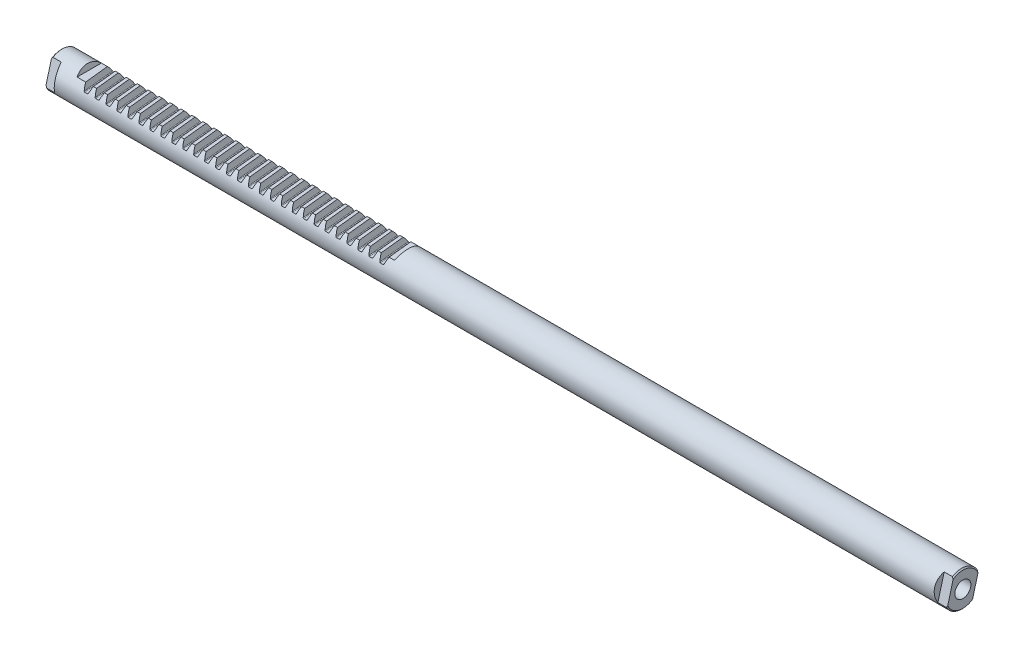
from build123d import *

# Parameters (mm, degrees)
ENL_V_MAT_EXTRU_1_DEPTH    = 12.5
ENL_V_MAT_EXTRU_2_DEPTH    = 12.5
R_P_TITION_LIN_AIRE2_COUNT = 28
R_P_TITION_LIN_AIRE2_PITCH = 6.8
ENL_V_MAT_EXTRU_3_DEPTH    = 12.5


with BuildPart() as part:
    # Esquisse1 → Base-Révolution (revolve)
    with BuildSketch(Plane.XY, mode=Mode.PRIVATE) as base_r_volution_sk:
        Polygon((-257.113248654, 0), (257.113248654, 0), (260, 5), (280, 5), (280, 10.292893219), (279.292893219, 11), (-279.292893219, 11), (-280, 10.292893219), (-280, 5), (-260, 5), align=None)
    revolve(base_r_volution_sk.sketch.rotate(Axis((301, 0, 0), (-1, 0, 0)), 61.658241773), axis=Axis((301, 0, 0), (-1, 0, 0)))

    # Esquisse2 → Enlèv. mat.-Extru.1 (cut, symmetric)
    with BuildSketch(Plane.XY):
        Polygon((-262.544119063, 8), (-65.455880937, 8), (-64, 12), (-264, 12), align=None)
    extrude(amount=ENL_V_MAT_EXTRU_1_DEPTH, both=True, mode=Mode.SUBTRACT)

    # Esquisse4 → Enlèv. mat.-Extru.2 (cut, symmetric)
    with BuildSketch(Plane(origin=(-514.586649005, 0, 26.968343523), x_dir=(-0.9945218953682733, 0, 0.10452846326765368), z_dir=(-0.10452846326765368, 0, -0.9945218953682733))):
        with BuildLine():
            Line((-262.8, 8), (-261.691343001, 4.953989928))
            ThreePointArc((-261.691343001, 4.953989928), (-261.508284908, 4.715423978), (-261.22149669, 4.625))
            Line((-261.22149669, 4.625), (-259.57850331, 4.625))
            ThreePointArc((-259.57850331, 4.625), (-259.291715092, 4.715423978), (-259.108656999, 4.953989928))
            Line((-259.108656999, 4.953989928), (-258, 8))
            Line((-258, 8), (-262.8, 8))
        make_face()
    enl_v_mat_extru_2 = extrude(amount=ENL_V_MAT_EXTRU_2_DEPTH, both=True, mode=Mode.SUBTRACT)

    # Répétition linéaire2: Enlèv. mat.-Extru.2 ×28
    with Locations(*[(i * R_P_TITION_LIN_AIRE2_PITCH, 0, 0) for i in range(1, R_P_TITION_LIN_AIRE2_COUNT)]):
        add(enl_v_mat_extru_2, mode=Mode.SUBTRACT)

    # Esquisse6 → Enlèv. mat.-Extru.3 (cut, symmetric)
    with BuildSketch(Plane(origin=(0, 0, 0), x_dir=(-1, 0, 0), z_dir=(0, 0.9659258262890673, -0.2588190451025247))):
        Polygon((-283, 8), (-274.183821406, 8), (-272, 14), (-283, 14), align=None)
        Polygon((274.183821406, 8), (272, 14), (283, 14), (283, 8), align=None)
        Polygon((-283, -14), (-283, -8), (-274.183821406, -8), (-272, -14), align=None)
        Polygon((274.183821406, -8), (272, -14), (283, -14), (283, -8), align=None)
    extrude(amount=ENL_V_MAT_EXTRU_3_DEPTH, both=True, mode=Mode.SUBTRACT)


solid = part.part
